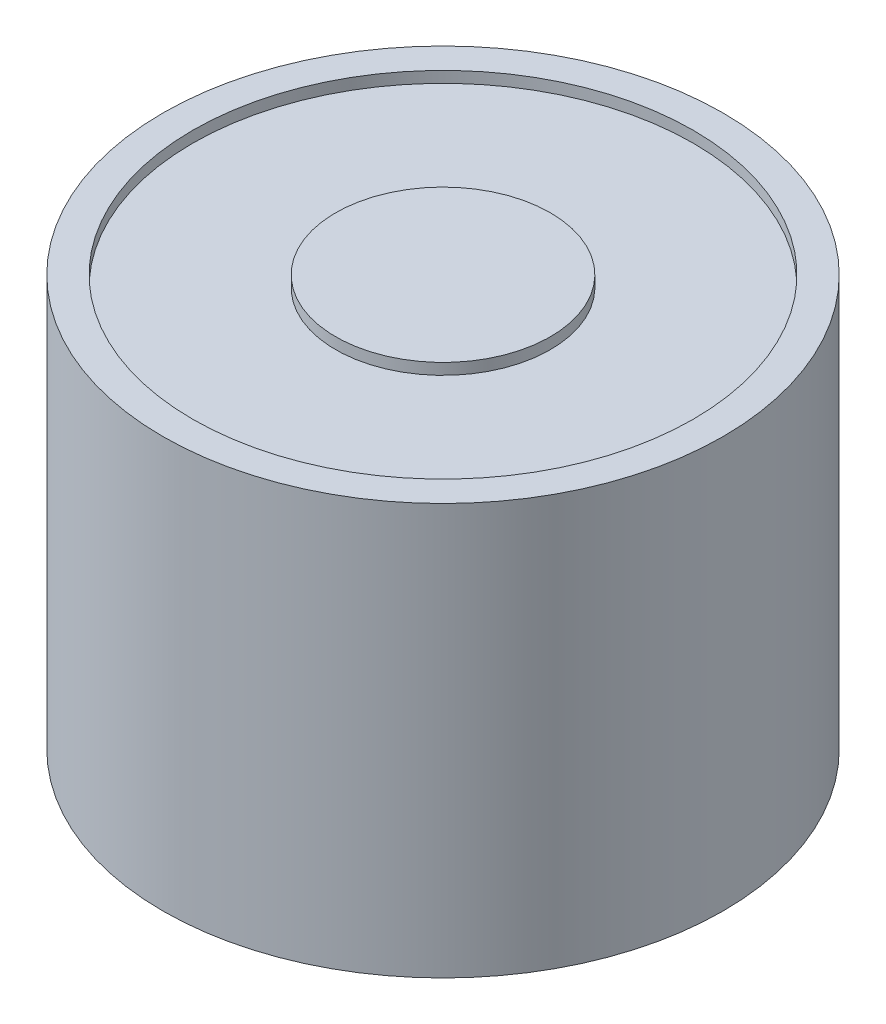
from build123d import *


with BuildPart() as part:
    # Sketch1 → Revolve1 (revolve)
    with BuildSketch(Plane.XY, mode=Mode.PRIVATE) as revolve1_sk:
        Polygon((0, 6), (0, 22), (5.75, 22), (5.75, 21.4), (13.4, 21.4), (13.4, 22), (15, 22), (15, 0), (2, 0), (2, 6), align=None)
    revolve(revolve1_sk.sketch.rotate(Axis((0, -2.826923077, 0), (0, 1, 0)), 90), axis=Axis((0, -2.826923077, 0), (0, 1, 0)))


solid = part.part
